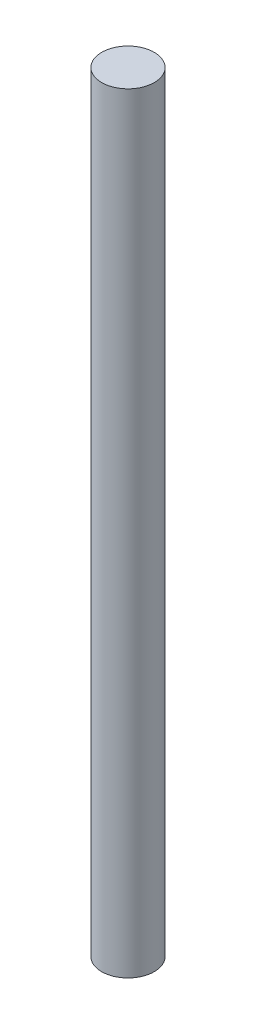
from build123d import *

# Parameters (mm, degrees)
SKETCH1_R           = 0.75
BOSS_EXTRUDE1_DEPTH = 22


with BuildPart() as part:
    # Sketch1 → Boss-Extrude1 (new body)
    with BuildSketch(Plane(origin=(0, 0, 0), x_dir=(1, 0, 0), z_dir=(0, 1, 0))):
        with Locations(Location((0, 0, 0), (0, 0, 270))):
            Circle(SKETCH1_R)
    extrude(amount=BOSS_EXTRUDE1_DEPTH)


solid = part.part
